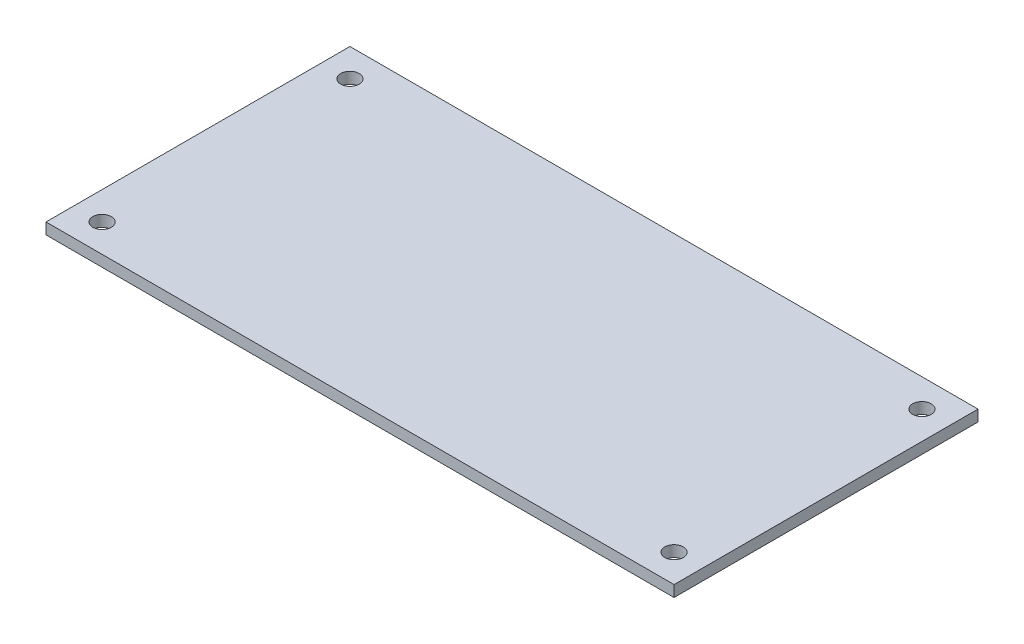
from build123d import *

# Parameters (mm, degrees)
SKETCH_1_W      = 112
SKETCH_1_H      = 54.2
SKETCH_1_R      = 1.65
EXTRUDE_1_DEPTH = 2


with BuildPart() as part:
    # 草图1 → 凸台-拉伸1 (new body)
    with BuildSketch(Plane(origin=(0, 0, 0), x_dir=(1, 0, 0), z_dir=(0, 1, 0))):
        with Locations((56, -27.1)):
            Rectangle(SKETCH_1_W, SKETCH_1_H)
        with Locations(Location((5, -5, 0), (0, 0, 270))):
            Circle(SKETCH_1_R, mode=Mode.SUBTRACT)
        with Locations(Location((107, -5, 0), (0, 0, 270))):
            Circle(SKETCH_1_R, mode=Mode.SUBTRACT)
        with Locations(Location((107, -49.2, 0), (0, 0, 270))):
            Circle(SKETCH_1_R, mode=Mode.SUBTRACT)
        with Locations(Location((5, -49.2, 0), (0, 0, 270))):
            Circle(SKETCH_1_R, mode=Mode.SUBTRACT)
    extrude(amount=EXTRUDE_1_DEPTH)


solid = part.part
